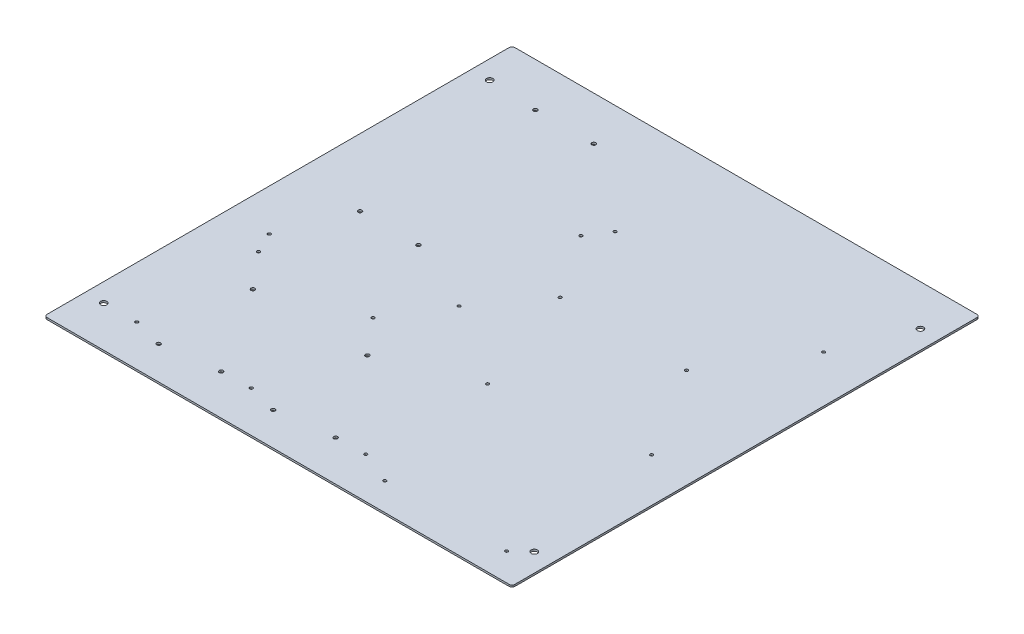
from build123d import *

# Parameters (mm, degrees)
SKETCH1_W           = 400.05
SKETCH1_H           = 400.05
BOSS_EXTRUDE1_DEPTH = 1.5875
CUT_EXTRUDE1_REACH  = 284.883
SKETCH2_R           = 2.665
FILLET1_R           = 2.54
CUT_EXTRUDE2_REACH  = 284.883
SKETCH3_R           = 1.665
CUT_EXTRUDE3_REACH  = 284.883
SKETCH4_R           = 1.665
CUT_EXTRUDE4_REACH  = 284.883
SKETCH5_R           = 1.27


with BuildPart() as part:
    # Sketch1 → Boss-Extrude1 (new body)
    with BuildSketch(Plane(origin=(0, 0, 0), x_dir=(1, 0, 0), z_dir=(0, 1, 0))):
        Rectangle(SKETCH1_W, SKETCH1_H)
    extrude(amount=BOSS_EXTRUDE1_DEPTH)

    # Sketch2 → Cut-Extrude1 (cut, up to next)
    with BuildSketch(Plane(origin=(0, 1.5875, 0), x_dir=(1, 0, 0), z_dir=(0, 1, 0)), mode=Mode.PRIVATE) as cut_extrude1_sk1:
        with Locations(Location((-184.15, -165.1, 0), (0, 0, 270))):
            Circle(SKETCH2_R)
    cut_extrude1_tool1 = extrude(cut_extrude1_sk1.sketch, amount=-CUT_EXTRUDE1_REACH, mode=Mode.PRIVATE) & part.part
    # Sketch2 → Cut-Extrude1 (cut, up to next)
    with BuildSketch(Plane(origin=(0, 1.5875, 0), x_dir=(1, 0, 0), z_dir=(0, 1, 0)), mode=Mode.PRIVATE) as cut_extrude1_sk2:
        with Locations(Location((184.15, -165.1, 0), (0, 0, 270))):
            Circle(SKETCH2_R)
    cut_extrude1_tool2 = extrude(cut_extrude1_sk2.sketch, amount=-CUT_EXTRUDE1_REACH, mode=Mode.PRIVATE) & part.part
    # Sketch2 → Cut-Extrude1 (cut, up to next)
    with BuildSketch(Plane(origin=(0, 1.5875, 0), x_dir=(1, 0, 0), z_dir=(0, 1, 0)), mode=Mode.PRIVATE) as cut_extrude1_sk3:
        with Locations(Location((184.15, 165.1, 0), (0, 0, 270))):
            Circle(SKETCH2_R)
    cut_extrude1_tool3 = extrude(cut_extrude1_sk3.sketch, amount=-CUT_EXTRUDE1_REACH, mode=Mode.PRIVATE) & part.part
    # Sketch2 → Cut-Extrude1 (cut, up to next)
    with BuildSketch(Plane(origin=(0, 1.5875, 0), x_dir=(1, 0, 0), z_dir=(0, 1, 0)), mode=Mode.PRIVATE) as cut_extrude1_sk4:
        with Locations(Location((-184.15, 165.1, 0), (0, 0, 270))):
            Circle(SKETCH2_R)
    cut_extrude1_tool4 = extrude(cut_extrude1_sk4.sketch, amount=-CUT_EXTRUDE1_REACH, mode=Mode.PRIVATE) & part.part
    add(cut_extrude1_tool1.solids().sort_by_distance((-184.15, 1.5875, 165.1))[0], mode=Mode.SUBTRACT)
    add(cut_extrude1_tool2.solids().sort_by_distance((184.15, 1.5875, 165.1))[0], mode=Mode.SUBTRACT)
    add(cut_extrude1_tool3.solids().sort_by_distance((184.15, 1.5875, -165.1))[0], mode=Mode.SUBTRACT)
    add(cut_extrude1_tool4.solids().sort_by_distance((-184.15, 1.5875, -165.1))[0], mode=Mode.SUBTRACT)

    # Fillet1
    fillet1_edges = [part.edges().sort_by_distance(p)[0] for p in [
        (200.025, 0.79375, 200.025),
        (-200.025, 0.79375, 200.025),
        (-200.025, 0.79375, -200.025),
        (200.025, 0.79375, -200.025),
    ]]
    fillet(fillet1_edges, radius=FILLET1_R)

    # Sketch3 → Cut-Extrude2 (cut, up to next)
    with BuildSketch(Plane.XZ, mode=Mode.PRIVATE) as cut_extrude2_sk1:
        with Locations(Location((-130.439708106, 171.766169153, 0), (0, 0, 270))):
            Circle(SKETCH3_R)
    cut_extrude2_tool1 = extrude(cut_extrude2_sk1.sketch, amount=-CUT_EXTRUDE2_REACH, mode=Mode.PRIVATE) & part.part
    # Sketch3 → Cut-Extrude2 (cut, up to next)
    with BuildSketch(Plane.XZ, mode=Mode.PRIVATE) as cut_extrude2_sk2:
        with Locations(Location((-83.186426808, 165.558058797, 0), (0, 0, 270))):
            Circle(SKETCH3_R)
    cut_extrude2_tool2 = extrude(cut_extrude2_sk2.sketch, amount=-CUT_EXTRUDE2_REACH, mode=Mode.PRIVATE) & part.part
    # Sketch3 → Cut-Extrude2 (cut, up to next)
    with BuildSketch(Plane.XZ, mode=Mode.PRIVATE) as cut_extrude2_sk3:
        with Locations(Location((-130.567422903, 91.046045503, 0), (0, 0, 270))):
            Circle(SKETCH3_R)
    cut_extrude2_tool3 = extrude(cut_extrude2_sk3.sketch, amount=-CUT_EXTRUDE2_REACH, mode=Mode.PRIVATE) & part.part
    # Sketch3 → Cut-Extrude2 (cut, up to next)
    with BuildSketch(Plane.XZ, mode=Mode.PRIVATE) as cut_extrude2_sk4:
        with Locations(Location((-32.50023816, 171.766169153, 0), (0, 0, 270))):
            Circle(SKETCH3_R)
    cut_extrude2_tool4 = extrude(cut_extrude2_sk4.sketch, amount=-CUT_EXTRUDE2_REACH, mode=Mode.PRIVATE) & part.part
    # Sketch3 → Cut-Extrude2 (cut, up to next)
    with BuildSketch(Plane.XZ, mode=Mode.PRIVATE) as cut_extrude2_sk5:
        with Locations(Location((14.753043138, 165.558058797, 0), (0, 0, 270))):
            Circle(SKETCH3_R)
    cut_extrude2_tool5 = extrude(cut_extrude2_sk5.sketch, amount=-CUT_EXTRUDE2_REACH, mode=Mode.PRIVATE) & part.part
    # Sketch3 → Cut-Extrude2 (cut, up to next)
    with BuildSketch(Plane.XZ, mode=Mode.PRIVATE) as cut_extrude2_sk6:
        with Locations(Location((-32.627952956, 91.046045503, 0), (0, 0, 270))):
            Circle(SKETCH3_R)
    cut_extrude2_tool6 = extrude(cut_extrude2_sk6.sketch, amount=-CUT_EXTRUDE2_REACH, mode=Mode.PRIVATE) & part.part
    add(cut_extrude2_tool1.solids().sort_by_distance((-130.439708, 0, 171.766169))[0], mode=Mode.SUBTRACT)
    add(cut_extrude2_tool2.solids().sort_by_distance((-83.186427, 0, 165.558059))[0], mode=Mode.SUBTRACT)
    add(cut_extrude2_tool3.solids().sort_by_distance((-130.567423, 0, 91.046046))[0], mode=Mode.SUBTRACT)
    add(cut_extrude2_tool4.solids().sort_by_distance((-32.500238, 0, 171.766169))[0], mode=Mode.SUBTRACT)
    add(cut_extrude2_tool5.solids().sort_by_distance((14.753043, 0, 165.558059))[0], mode=Mode.SUBTRACT)
    add(cut_extrude2_tool6.solids().sort_by_distance((-32.627953, 0, 91.046046))[0], mode=Mode.SUBTRACT)

    # Sketch4 → Cut-Extrude3 (cut, up to next)
    with BuildSketch(Plane(origin=(0, 1.5875, 0), x_dir=(1, 0, 0), z_dir=(0, 1, 0)), mode=Mode.PRIVATE) as cut_extrude3_sk1:
        with Locations(Location((-142.525, 162.525, 0), (0, 0, 270))):
            Circle(SKETCH4_R)
    cut_extrude3_tool1 = extrude(cut_extrude3_sk1.sketch, amount=-CUT_EXTRUDE3_REACH, mode=Mode.PRIVATE) & part.part
    # Sketch4 → Cut-Extrude3 (cut, up to next)
    with BuildSketch(Plane(origin=(0, 1.5875, 0), x_dir=(1, 0, 0), z_dir=(0, 1, 0)), mode=Mode.PRIVATE) as cut_extrude3_sk2:
        with Locations(Location((-92.525, 162.525, 0), (0, 0, 270))):
            Circle(SKETCH4_R)
    cut_extrude3_tool2 = extrude(cut_extrude3_sk2.sketch, amount=-CUT_EXTRUDE3_REACH, mode=Mode.PRIVATE) & part.part
    # Sketch4 → Cut-Extrude3 (cut, up to next)
    with BuildSketch(Plane(origin=(0, 1.5875, 0), x_dir=(1, 0, 0), z_dir=(0, 1, 0)), mode=Mode.PRIVATE) as cut_extrude3_sk3:
        with Locations(Location((-92.525, 12.525, 0), (0, 0, 270))):
            Circle(SKETCH4_R)
    cut_extrude3_tool3 = extrude(cut_extrude3_sk3.sketch, amount=-CUT_EXTRUDE3_REACH, mode=Mode.PRIVATE) & part.part
    # Sketch4 → Cut-Extrude3 (cut, up to next)
    with BuildSketch(Plane(origin=(0, 1.5875, 0), x_dir=(1, 0, 0), z_dir=(0, 1, 0)), mode=Mode.PRIVATE) as cut_extrude3_sk4:
        with Locations(Location((-142.525, 12.525, 0), (0, 0, 270))):
            Circle(SKETCH4_R)
    cut_extrude3_tool4 = extrude(cut_extrude3_sk4.sketch, amount=-CUT_EXTRUDE3_REACH, mode=Mode.PRIVATE) & part.part
    add(cut_extrude3_tool1.solids().sort_by_distance((-142.525, 1.5875, -162.525))[0], mode=Mode.SUBTRACT)
    add(cut_extrude3_tool2.solids().sort_by_distance((-92.525, 1.5875, -162.525))[0], mode=Mode.SUBTRACT)
    add(cut_extrude3_tool3.solids().sort_by_distance((-92.525, 1.5875, -12.525))[0], mode=Mode.SUBTRACT)
    add(cut_extrude3_tool4.solids().sort_by_distance((-142.525, 1.5875, -12.525))[0], mode=Mode.SUBTRACT)

    # Sketch5 → Cut-Extrude4 (cut, up to next)
    with BuildSketch(Plane(origin=(0, 1.5875, 0), x_dir=(1, 0, 0), z_dir=(0, 1, 0)), mode=Mode.PRIVATE) as cut_extrude4_sk1:
        with Locations(Location((114.883029897, 34.336429963, 0), (0, 0, 270))):
            Circle(SKETCH5_R)
    cut_extrude4_tool1 = extrude(cut_extrude4_sk1.sketch, amount=-CUT_EXTRUDE4_REACH, mode=Mode.PRIVATE) & part.part
    # Sketch5 → Cut-Extrude4 (cut, up to next)
    with BuildSketch(Plane(origin=(0, 1.5875, 0), x_dir=(1, 0, 0), z_dir=(0, 1, 0)), mode=Mode.PRIVATE) as cut_extrude4_sk2:
        with Locations(Location((160.02, 106.5284, 0), (0, 0, 270))):
            Circle(SKETCH5_R)
    cut_extrude4_tool2 = extrude(cut_extrude4_sk2.sketch, amount=-CUT_EXTRUDE4_REACH, mode=Mode.PRIVATE) & part.part
    # Sketch5 → Cut-Extrude4 (cut, up to next)
    with BuildSketch(Plane(origin=(0, 1.5875, 0), x_dir=(1, 0, 0), z_dir=(0, 1, 0)), mode=Mode.PRIVATE) as cut_extrude4_sk3:
        with Locations(Location((-18.415, 106.5284, 0), (0, 0, 270))):
            Circle(SKETCH5_R)
    cut_extrude4_tool3 = extrude(cut_extrude4_sk3.sketch, amount=-CUT_EXTRUDE4_REACH, mode=Mode.PRIVATE) & part.part
    # Sketch5 → Cut-Extrude4 (cut, up to next)
    with BuildSketch(Plane(origin=(0, 1.5875, 0), x_dir=(1, 0, 0), z_dir=(0, 1, 0)), mode=Mode.PRIVATE) as cut_extrude4_sk4:
        with Locations(Location((-29.9466, 88.85, 0), (0, 0, 270))):
            Circle(SKETCH5_R)
    cut_extrude4_tool4 = extrude(cut_extrude4_sk4.sketch, amount=-CUT_EXTRUDE4_REACH, mode=Mode.PRIVATE) & part.part
    # Sketch5 → Cut-Extrude4 (cut, up to next)
    with BuildSketch(Plane(origin=(0, 1.5875, 0), x_dir=(1, 0, 0), z_dir=(0, 1, 0)), mode=Mode.PRIVATE) as cut_extrude4_sk5:
        with Locations(Location((-29.9466, -15.29, 0), (0, 0, 270))):
            Circle(SKETCH5_R)
    cut_extrude4_tool5 = extrude(cut_extrude4_sk5.sketch, amount=-CUT_EXTRUDE4_REACH, mode=Mode.PRIVATE) & part.part
    # Sketch5 → Cut-Extrude4 (cut, up to next)
    with BuildSketch(Plane(origin=(0, 1.5875, 0), x_dir=(1, 0, 0), z_dir=(0, 1, 0)), mode=Mode.PRIVATE) as cut_extrude4_sk6:
        with Locations(Location((6.883029897, 34.336429963, 0), (0, 0, 270))):
            Circle(SKETCH5_R)
    cut_extrude4_tool6 = extrude(cut_extrude4_sk6.sketch, amount=-CUT_EXTRUDE4_REACH, mode=Mode.PRIVATE) & part.part
    # Sketch5 → Cut-Extrude4 (cut, up to next)
    with BuildSketch(Plane(origin=(0, 1.5875, 0), x_dir=(1, 0, 0), z_dir=(0, 1, 0)), mode=Mode.PRIVATE) as cut_extrude4_sk7:
        with Locations(Location((-164.465, -43.1284, 0), (0, 0, 270))):
            Circle(SKETCH5_R)
    cut_extrude4_tool7 = extrude(cut_extrude4_sk7.sketch, amount=-CUT_EXTRUDE4_REACH, mode=Mode.PRIVATE) & part.part
    # Sketch5 → Cut-Extrude4 (cut, up to next)
    with BuildSketch(Plane(origin=(0, 1.5875, 0), x_dir=(1, 0, 0), z_dir=(0, 1, 0)), mode=Mode.PRIVATE) as cut_extrude4_sk8:
        with Locations(Location((-155.9966, -60.8068, 0), (0, 0, 270))):
            Circle(SKETCH5_R)
    cut_extrude4_tool8 = extrude(cut_extrude4_sk8.sketch, amount=-CUT_EXTRUDE4_REACH, mode=Mode.PRIVATE) & part.part
    # Sketch5 → Cut-Extrude4 (cut, up to next)
    with BuildSketch(Plane(origin=(0, 1.5875, 0), x_dir=(1, 0, 0), z_dir=(0, 1, 0)), mode=Mode.PRIVATE) as cut_extrude4_sk9:
        with Locations(Location((-155.9966, -164.9468, 0), (0, 0, 270))):
            Circle(SKETCH5_R)
    cut_extrude4_tool9 = extrude(cut_extrude4_sk9.sketch, amount=-CUT_EXTRUDE4_REACH, mode=Mode.PRIVATE) & part.part
    # Sketch5 → Cut-Extrude4 (cut, up to next)
    with BuildSketch(Plane(origin=(0, 1.5875, 0), x_dir=(1, 0, 0), z_dir=(0, 1, 0)), mode=Mode.PRIVATE) as cut_extrude4_sk10:
        with Locations(Location((-58.057130054, -164.9468, 0), (0, 0, 270))):
            Circle(SKETCH5_R)
    cut_extrude4_tool10 = extrude(cut_extrude4_sk10.sketch, amount=-CUT_EXTRUDE4_REACH, mode=Mode.PRIVATE) & part.part
    # Sketch5 → Cut-Extrude4 (cut, up to next)
    with BuildSketch(Plane(origin=(0, 1.5875, 0), x_dir=(1, 0, 0), z_dir=(0, 1, 0)), mode=Mode.PRIVATE) as cut_extrude4_sk11:
        with Locations(Location((39.882339893, -164.9468, 0), (0, 0, 270))):
            Circle(SKETCH5_R)
    cut_extrude4_tool11 = extrude(cut_extrude4_sk11.sketch, amount=-CUT_EXTRUDE4_REACH, mode=Mode.PRIVATE) & part.part
    # Sketch5 → Cut-Extrude4 (cut, up to next)
    with BuildSketch(Plane(origin=(0, 1.5875, 0), x_dir=(1, 0, 0), z_dir=(0, 1, 0)), mode=Mode.PRIVATE) as cut_extrude4_sk12:
        with Locations(Location((67.720739893, -176.4784, 0), (0, 0, 270))):
            Circle(SKETCH5_R)
    cut_extrude4_tool12 = extrude(cut_extrude4_sk12.sketch, amount=-CUT_EXTRUDE4_REACH, mode=Mode.PRIVATE) & part.part
    # Sketch5 → Cut-Extrude4 (cut, up to next)
    with BuildSketch(Plane(origin=(0, 1.5875, 0), x_dir=(1, 0, 0), z_dir=(0, 1, 0)), mode=Mode.PRIVATE) as cut_extrude4_sk13:
        with Locations(Location((171.860739893, -176.4784, 0), (0, 0, 270))):
            Circle(SKETCH5_R)
    cut_extrude4_tool13 = extrude(cut_extrude4_sk13.sketch, amount=-CUT_EXTRUDE4_REACH, mode=Mode.PRIVATE) & part.part
    # Sketch5 → Cut-Extrude4 (cut, up to next)
    with BuildSketch(Plane(origin=(0, 1.5875, 0), x_dir=(1, 0, 0), z_dir=(0, 1, 0)), mode=Mode.PRIVATE) as cut_extrude4_sk14:
        with Locations(Location((39.882339893, -60.8068, 0), (0, 0, 270))):
            Circle(SKETCH5_R)
    cut_extrude4_tool14 = extrude(cut_extrude4_sk14.sketch, amount=-CUT_EXTRUDE4_REACH, mode=Mode.PRIVATE) & part.part
    # Sketch5 → Cut-Extrude4 (cut, up to next)
    with BuildSketch(Plane(origin=(0, 1.5875, 0), x_dir=(1, 0, 0), z_dir=(0, 1, 0)), mode=Mode.PRIVATE) as cut_extrude4_sk15:
        with Locations(Location((-58.057130054, -60.8068, 0), (0, 0, 270))):
            Circle(SKETCH5_R)
    cut_extrude4_tool15 = extrude(cut_extrude4_sk15.sketch, amount=-CUT_EXTRUDE4_REACH, mode=Mode.PRIVATE) & part.part
    # Sketch5 → Cut-Extrude4 (cut, up to next)
    with BuildSketch(Plane(origin=(0, 1.5875, 0), x_dir=(1, 0, 0), z_dir=(0, 1, 0)), mode=Mode.PRIVATE) as cut_extrude4_sk16:
        with Locations(Location((162.56, -43.1284, 0), (0, 0, 270))):
            Circle(SKETCH5_R)
    cut_extrude4_tool16 = extrude(cut_extrude4_sk16.sketch, amount=-CUT_EXTRUDE4_REACH, mode=Mode.PRIVATE) & part.part
    add(cut_extrude4_tool1.solids().sort_by_distance((114.88303, 1.5875, -34.33643))[0], mode=Mode.SUBTRACT)
    add(cut_extrude4_tool2.solids().sort_by_distance((160.02, 1.5875, -106.5284))[0], mode=Mode.SUBTRACT)
    add(cut_extrude4_tool3.solids().sort_by_distance((-18.415, 1.5875, -106.5284))[0], mode=Mode.SUBTRACT)
    add(cut_extrude4_tool4.solids().sort_by_distance((-29.9466, 1.5875, -88.85))[0], mode=Mode.SUBTRACT)
    add(cut_extrude4_tool5.solids().sort_by_distance((-29.9466, 1.5875, 15.29))[0], mode=Mode.SUBTRACT)
    add(cut_extrude4_tool6.solids().sort_by_distance((6.88303, 1.5875, -34.33643))[0], mode=Mode.SUBTRACT)
    add(cut_extrude4_tool7.solids().sort_by_distance((-164.465, 1.5875, 43.1284))[0], mode=Mode.SUBTRACT)
    add(cut_extrude4_tool8.solids().sort_by_distance((-155.9966, 1.5875, 60.8068))[0], mode=Mode.SUBTRACT)
    add(cut_extrude4_tool9.solids().sort_by_distance((-155.9966, 1.5875, 164.9468))[0], mode=Mode.SUBTRACT)
    add(cut_extrude4_tool10.solids().sort_by_distance((-58.05713, 1.5875, 164.9468))[0], mode=Mode.SUBTRACT)
    add(cut_extrude4_tool11.solids().sort_by_distance((39.88234, 1.5875, 164.9468))[0], mode=Mode.SUBTRACT)
    add(cut_extrude4_tool12.solids().sort_by_distance((67.72074, 1.5875, 176.4784))[0], mode=Mode.SUBTRACT)
    add(cut_extrude4_tool13.solids().sort_by_distance((171.86074, 1.5875, 176.4784))[0], mode=Mode.SUBTRACT)
    add(cut_extrude4_tool14.solids().sort_by_distance((39.88234, 1.5875, 60.8068))[0], mode=Mode.SUBTRACT)
    add(cut_extrude4_tool15.solids().sort_by_distance((-58.05713, 1.5875, 60.8068))[0], mode=Mode.SUBTRACT)
    add(cut_extrude4_tool16.solids().sort_by_distance((162.56, 1.5875, 43.1284))[0], mode=Mode.SUBTRACT)


solid = part.part
